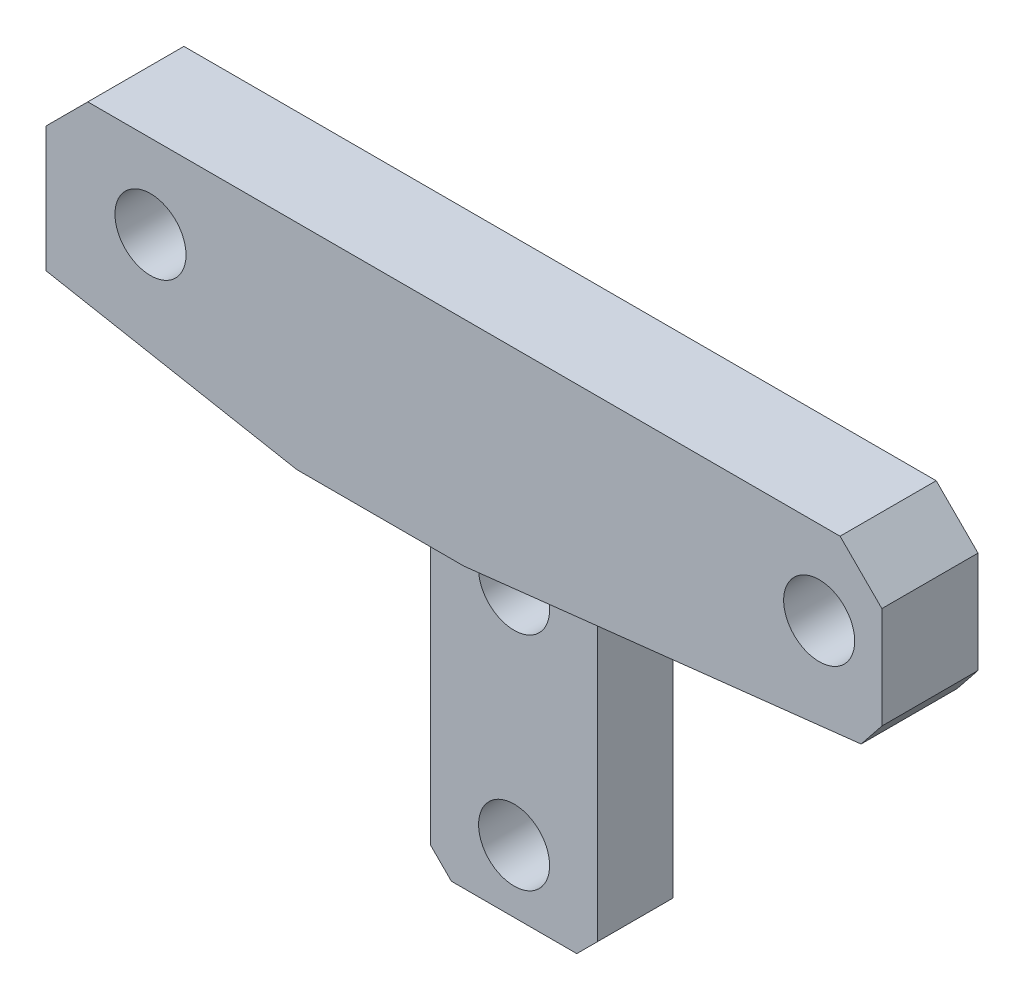
from build123d import *

# Parameters (mm, degrees)
SKETCH_1_R          = 0.85
EXTRUDE_2_DEPTH     = 5.5
CUT_EXTRUDE_START   = 3.2
SKETCH_3_W          = 4
SKETCH_3_H          = 9.88
SKETCH_3_R          = 0.85
CUT_EXTRUDE_2_DEPTH = 3.2
CHAMFER_1_SIZE      = 1
CHAMFER_2_SIZE      = 1
CHAMFER_3_SIZE      = 0.5
SKETCH_4_R          = 0.85
CUT_EXTRUDE_3_DEPTH = 3.2
CHAMFER_4_SIZE      = 0.5
CHAMFER_4_SIZE2     = 0.566583589
CUT_EXTRUDE_4_DEPTH = 0.5


with BuildPart() as part:
    # 草图1 → 凸台-拉伸2 (new body)
    with BuildSketch(Plane.XY):
        Polygon((-10, 2), (10, 2), (10, -2), (0, -3.12), (0, -13), (-4, -13), (-4, -3.12), (-10, -2), align=None)
        with Locations((-7.5, 0)):
            Circle(SKETCH_1_R, mode=Mode.SUBTRACT)
        with Locations((8.5, 0)):
            Circle(SKETCH_1_R, mode=Mode.SUBTRACT)
        with Locations((-2, -11.5)):
            Circle(SKETCH_1_R, mode=Mode.SUBTRACT)
        with Locations((-2, -6.2)):
            Circle(SKETCH_1_R, mode=Mode.SUBTRACT)
    extrude(amount=EXTRUDE_2_DEPTH)

    # 草图3 → 切除-拉伸2 (cut)
    with BuildSketch(Plane(origin=(0, 0, 5.5), x_dir=(-1, 0, 0), z_dir=(0, 0, -1)).offset(CUT_EXTRUDE_START)):
        with Locations((2, -8.06)):
            Rectangle(SKETCH_3_W, SKETCH_3_H)
        with Locations((2, -11.5)):
            Circle(SKETCH_3_R, mode=Mode.SUBTRACT)
        with Locations((2, -6.2)):
            Circle(SKETCH_3_R, mode=Mode.SUBTRACT)
    extrude(amount=-CUT_EXTRUDE_2_DEPTH, mode=Mode.SUBTRACT)

    # 倒角1
    chamfer_1_edges = [part.edges().sort_by_distance(p)[0] for p in [
        (-2, -3.12, 2.3),
    ]]
    chamfer(chamfer_1_edges, length=CHAMFER_1_SIZE)

    # 倒角2
    chamfer_2_edges = [part.edges().sort_by_distance(p)[0] for p in [
        (-10, 2, 2.75),
        (10, 2, 2.75),
    ]]
    chamfer(chamfer_2_edges, length=CHAMFER_2_SIZE)

    # 倒角3
    chamfer_3_edges = [part.edges().sort_by_distance(p)[0] for p in [
        (0, -13, 1.15),
        (-4, -13, 1.15),
    ]]
    chamfer(chamfer_3_edges, length=CHAMFER_3_SIZE)

    # 草图4 → 切除-拉伸3 (cut)
    with BuildSketch(Plane.XY):
        Polygon((-10, -2.5), (10, -2.5), (10, 1), (9, 2), (-9, 2), (-10, 1), align=None)
        with Locations((8.5, 0)):
            Circle(SKETCH_4_R, mode=Mode.SUBTRACT)
        with Locations((-7.5, 0)):
            Circle(SKETCH_4_R, mode=Mode.SUBTRACT)
    extrude(amount=CUT_EXTRUDE_3_DEPTH, mode=Mode.SUBTRACT)

    # 倒角4
    chamfer_4_edges = [part.edges().sort_by_distance(p)[0] for p in [
        (10, -2, 4.35),
    ]]
    chamfer_4_side = [part.faces().sort_by_distance(p)[0] for p in [
        (4.028822055, -2.66877193, 3.153508772),
    ]]
    chamfer(chamfer_4_edges, length=CHAMFER_4_SIZE, length2=CHAMFER_4_SIZE2, reference=chamfer_4_side[0])

    # 草图5 → 切除-拉伸4 (cut)
    with BuildSketch(Plane(origin=(0, 0, 0), x_dir=(-1, 0, 0), z_dir=(0, 0, -1))):
        Polygon((4, -3.12), (7.321428571, -2.5), (-5.535714286, -2.5), (0, -3.12), (0, -12.5), (0.5, -13), (3.5, -13), (4, -12.5), align=None)
    extrude(amount=-CUT_EXTRUDE_4_DEPTH, mode=Mode.SUBTRACT)


solid = part.part
